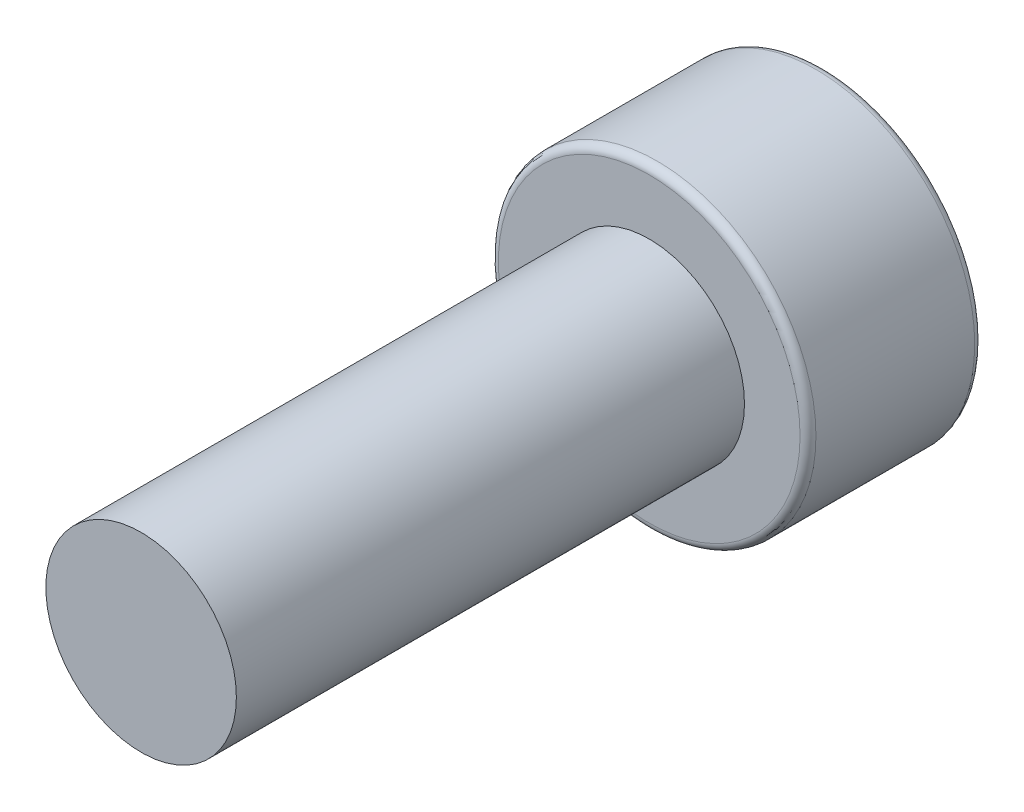
from build123d import *

# Parameters (mm, degrees)
SKETCH1_R           = 2.5
BOSS_EXTRUDE1_DEPTH = 2.75
SKETCH2_R           = 1.5
BOSS_EXTRUDE2_DEPTH = 8
CUT_EXTRUDE1_DEPTH  = 2
CHAMFER1_SIZE       = 0.25
FILLET1_R           = 0.125


with BuildPart() as part:
    # Sketch1 → Boss-Extrude1 (new body)
    with BuildSketch(Plane.XY):
        Circle(SKETCH1_R)
    extrude(amount=BOSS_EXTRUDE1_DEPTH)

    # Sketch2 → Boss-Extrude2 (add)
    with BuildSketch(Plane.XY.offset(2.75)):
        Circle(SKETCH2_R)
    extrude(amount=BOSS_EXTRUDE2_DEPTH)

    # Sketch3 → Cut-Extrude1 (cut)
    with BuildSketch(Plane(origin=(0, 0, 0), x_dir=(-1, 0, 0), z_dir=(0, 0, -1))):
        Polygon((1.443375673, 0), (0.721687836, 1.25), (-0.721687836, 1.25), (-1.443375673, 0), (-0.721687836, -1.25), (0.721687836, -1.25), align=None)
    extrude(amount=-CUT_EXTRUDE1_DEPTH, mode=Mode.SUBTRACT)

    # Chamfer1
    chamfer1_edges = [part.edges().sort_by_distance(p)[0] for p in [
        (-1.082531755, -0.625, 2),
        (0, -1.25, 2),
        (1.082531755, -0.625, 2),
        (1.082531755, 0.625, 2),
        (0, 1.25, 2),
        (-1.082531755, 0.625, 2),
    ]]
    chamfer(chamfer1_edges, length=CHAMFER1_SIZE)

    # Fillet1
    fillet1_edges = [part.edges().sort_by_distance(p)[0] for p in [
        (-1.082531755, -0.625, 0),
        (-1.082531755, 0.625, 0),
        (0, 1.25, 0),
        (1.082531755, 0.625, 0),
        (1.082531755, -0.625, 0),
        (0, -1.25, 0),
        (-2.5, 0, 0),
        (-2.5, 0, 2.75),
    ]]
    fillet(fillet1_edges, radius=FILLET1_R)


solid = part.part
